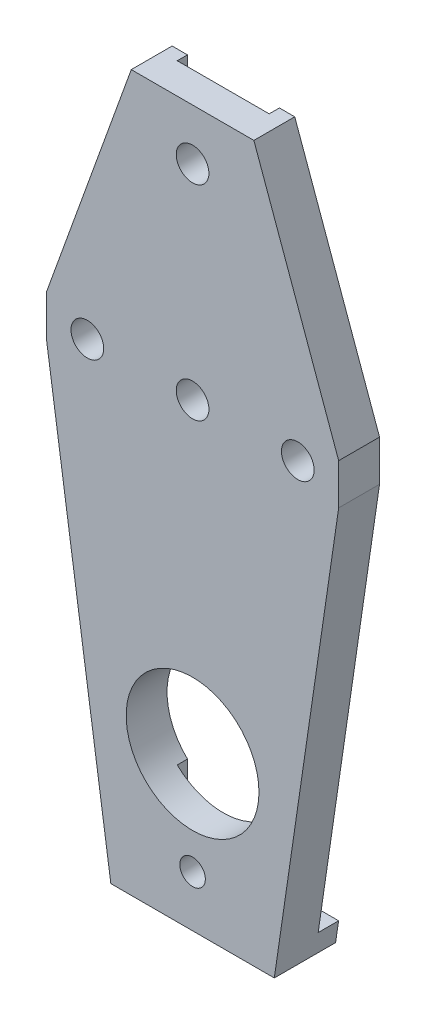
from build123d import *

# Parameters (mm, degrees)
MODEL_R                      = 1.6
EXTRUDE_4_DEPTH              = 4
EXTRUDE_4_2_DEPTH            = 4
MODEL_7_R                    = 1.6
EXTRUDE_5_DEPTH              = 3
EXTRUDE_6_DEPTH              = 6
CHAMFER_2_SIZE               = 1.65
SKETCH_1_R                   = 1.249437098
CUT_EXTRUDE_1_DEPTH          = 10
HOLE_WIZARD_M3_2_D           = 2.5
HOLE_WIZARD_M3_2_CSINK_D     = 3.05
HOLE_WIZARD_M3_2_CSINK_ANGLE = 90


with BuildPart() as part:
    # Model → 凸台-拉伸4 (new body)
    with BuildSketch(Plane.XY):
        with BuildLine():
            Line((37.840606061, 9.454545455), (29.540606061, 32.454545455))
            Line((29.540606061, 32.454545455), (28.040606061, 32.454545455))
            Line((28.040606061, 32.454545455), (28.040606061, -17.855038786))
            ThreePointArc((28.040606061, -17.855038786), (30.040606061, -22.545454545), (28.040606061, -27.235870305))
            Line((28.040606061, -27.235870305), (28.040606061, -37.545454545))
            Line((28.040606061, -37.545454545), (31.540606061, -37.545454545))
            Line((31.540606061, -37.545454545), (37.840606061, 5.454545455))
            Line((37.840606061, 5.454545455), (37.840606061, 9.454545455))
        make_face()
        with Locations((33.840606061, 7.454545455)):
            Circle(MODEL_R, mode=Mode.SUBTRACT)
    extrude(amount=-EXTRUDE_4_DEPTH)



with BuildPart() as body_2:
    # Model → Extrude 4 2 (new body)
    with BuildSketch(Plane.XY):
        with BuildLine():
            Line((19.040606061, -17.855038786), (19.040606061, 32.454545455))
            Line((19.040606061, 32.454545455), (17.540606061, 32.454545455))
            Line((17.540606061, 32.454545455), (9.240606061, 9.454545455))
            Line((9.240606061, 9.454545455), (9.240606061, 5.454545455))
            Line((9.240606061, 5.454545455), (15.540606061, -37.545454545))
            Line((15.540606061, -37.545454545), (19.040606061, -37.545454545))
            Line((19.040606061, -37.545454545), (19.040606061, -27.235870305))
            ThreePointArc((19.040606061, -27.235870305), (17.040606061, -22.545454545), (19.040606061, -17.855038786))
        make_face()
        with Locations((13.240606061, 7.454545455)):
            Circle(MODEL_R, mode=Mode.SUBTRACT)
    extrude(amount=-EXTRUDE_4_2_DEPTH)


with BuildPart() as part_1:
    add(part.part)

    add(body_2.part)  # 凸台-拉伸5 merges body 2
    # Model<7> → 凸台-拉伸5 (add)
    # profile 1 of 2: a face of its own
    with BuildSketch(Plane.XY):
        with BuildLine():
            Line((28.040606061, -17.855038786), (28.040606061, 32.454545455))
            Line((28.040606061, 32.454545455), (19.040606061, 32.454545455))
            Line((19.040606061, 32.454545455), (19.040606061, -17.855038786))
            ThreePointArc((19.040606061, -17.855038786), (23.540606061, -16.045454545), (28.040606061, -17.855038786))
        make_face()
        with Locations((23.540606061, 7.454545455)):
            Circle(MODEL_7_R, mode=Mode.SUBTRACT)
        with Locations((23.540606061, 27.454545455)):
            Circle(MODEL_7_R, mode=Mode.SUBTRACT)
    # profile 2 of 2: a face of its own
    with BuildSketch(Plane.XY):
        with BuildLine():
            Line((28.040606061, -37.545454545), (28.040606061, -27.235870305))
            ThreePointArc((28.040606061, -27.235870305), (23.540606061, -29.045454545), (19.040606061, -27.235870305))
            Line((19.040606061, -27.235870305), (19.040606061, -37.545454545))
            Line((19.040606061, -37.545454545), (28.040606061, -37.545454545))
        make_face()
    extrude(amount=-EXTRUDE_5_DEPTH)

    # Model<8> → 凸台-拉伸6 (add)
    with BuildSketch(Plane.XY):
        Polygon((31.540606061, -37.545454545), (31.833629316, -35.545454545), (28.04060606, -35.545454545), (28.040606061, -37.545454545), align=None)
        Polygon((19.040606061, -37.545454545), (19.040606061, -35.545454545), (15.247582805, -35.545454545), (15.540606061, -37.545454545), align=None)
    extrude(amount=-EXTRUDE_6_DEPTH)

    # 倒角2
    chamfer_2_edges = [part_1.edges().sort_by_distance(p)[0] for p in [
        (11.640606061, 7.454545455, -4),
        (32.240606061, 7.454545455, -4),
    ]]
    chamfer(chamfer_2_edges, length=CHAMFER_2_SIZE)

    # 草图1 → 切除-拉伸1 (cut)
    with BuildSketch(Plane(origin=(0, 0, -3), x_dir=(-1, 0, 0), z_dir=(0, 0, -1))):
        with Locations((-23.540606061, -32.545454545)):
            Circle(SKETCH_1_R)
    extrude(amount=-CUT_EXTRUDE_1_DEPTH, mode=Mode.SUBTRACT)

    # M3 螺纹孔2 (through all)
    with Locations(Plane(origin=(23.540606061, -32.545454545, -3), x_dir=(-1, 0, 0), z_dir=(0, 0, -1))):
        with Locations((0, 0)):
            CounterSinkHole(HOLE_WIZARD_M3_2_D / 2, HOLE_WIZARD_M3_2_CSINK_D / 2, counter_sink_angle=HOLE_WIZARD_M3_2_CSINK_ANGLE)


solid = part_1.part
